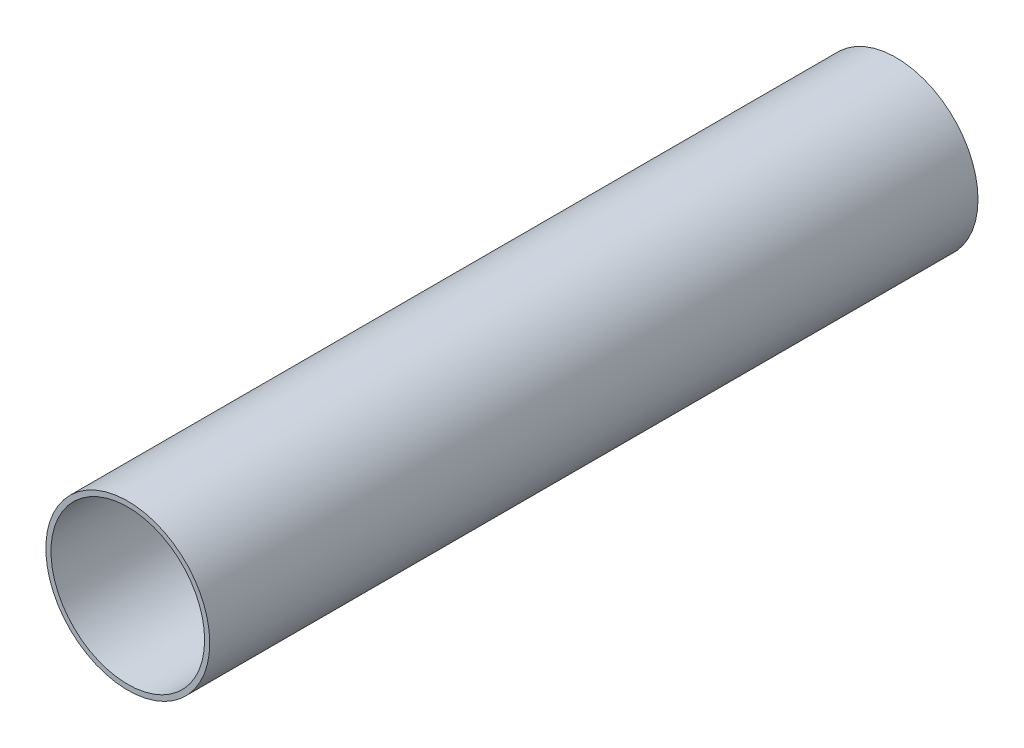
from build123d import *

# Parameters (mm, degrees)
SKETCH1_R           = 20.32
SKETCH1_R_2         = 19.05
EXTRUDE_THIN1_DEPTH = 190.5


with BuildPart() as part:
    # Sketch1 → Extrude-Thin1 (new body)
    with BuildSketch(Plane.XY):
        Circle(SKETCH1_R)
        Circle(SKETCH1_R_2, mode=Mode.SUBTRACT)
    extrude(amount=EXTRUDE_THIN1_DEPTH)


solid = part.part
